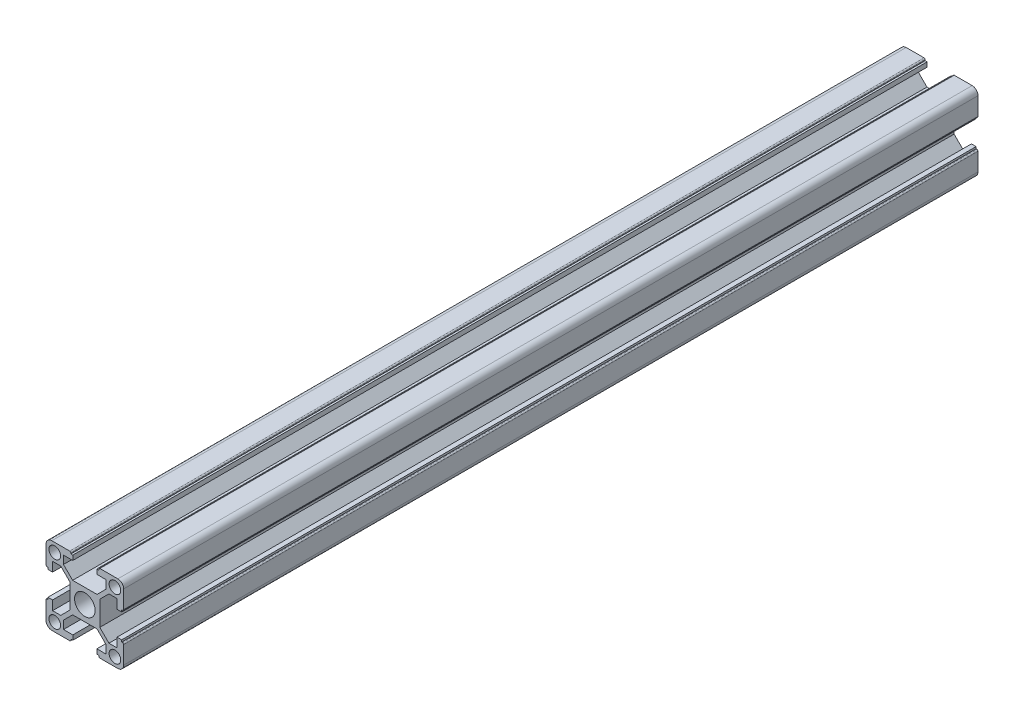
from build123d import *

# Parameters (mm, degrees)
SKETCH_1_R          = 2.65
SKETCH_1_R_2        = 1.5
EXTRUDE_1_DEPTH     = 110
SKETCH_4_R          = 2
CUT_EXTRUDE_3_DEPTH = 112.318563142


with BuildPart() as part:
    # 草图1 → 凸台-拉伸1 (new, symmetric)
    with BuildSketch(Plane.XY):
        with BuildLine():
            Line((3.142893219, 3.85), (-3.142893219, 3.85))
            Line((-3.142893219, 3.85), (-5.5, 6.207106781))
            Line((-5.5, 6.207106781), (-5.5, 8.3))
            Line((-5.5, 8.3), (-3.1, 8.3))
            Line((-3.1, 8.3), (-3.1, 9.5))
            Line((-3.1, 9.5), (-3.6, 9.5))
            Line((-3.6, 9.5), (-3.6, 9.7))
            ThreePointArc((-3.6, 9.7), (-3.687867966, 9.912132034), (-3.9, 10))
            Line((-3.9, 10), (-8.5, 10))
            ThreePointArc((-8.5, 10), (-9.560660172, 9.560660172), (-10, 8.5))
            Line((-10, 8.5), (-10, 3.9))
            ThreePointArc((-10, 3.9), (-9.912132034, 3.687867966), (-9.7, 3.6))
            Line((-9.7, 3.6), (-9.5, 3.6))
            Line((-9.5, 3.6), (-9.5, 3.1))
            Line((-9.5, 3.1), (-8.3, 3.1))
            Line((-8.3, 3.1), (-8.3, 5.5))
            Line((-8.3, 5.5), (-6.207106781, 5.5))
            Line((-6.207106781, 5.5), (-3.85, 3.142893219))
            Line((-3.85, 3.142893219), (-3.85, -3.142893219))
            Line((-3.85, -3.142893219), (-6.207106781, -5.5))
            Line((-6.207106781, -5.5), (-8.3, -5.5))
            Line((-8.3, -5.5), (-8.3, -3.1))
            Line((-8.3, -3.1), (-9.5, -3.1))
            Line((-9.5, -3.1), (-9.5, -3.6))
            Line((-9.5, -3.6), (-9.7, -3.6))
            ThreePointArc((-9.7, -3.6), (-9.912132034, -3.687867966), (-10, -3.9))
            Line((-10, -3.9), (-10, -8.5))
            ThreePointArc((-10, -8.5), (-9.560660172, -9.560660172), (-8.5, -10))
            Line((-8.5, -10), (-3.9, -10))
            ThreePointArc((-3.9, -10), (-3.687867966, -9.912132034), (-3.6, -9.7))
            Line((-3.6, -9.7), (-3.6, -9.5))
            Line((-3.6, -9.5), (-3.1, -9.5))
            Line((-3.1, -9.5), (-3.1, -8.3))
            Line((-3.1, -8.3), (-5.5, -8.3))
            Line((-5.5, -8.3), (-5.5, -6.207106781))
            Line((-5.5, -6.207106781), (-3.142893219, -3.85))
            Line((-3.142893219, -3.85), (3.142893219, -3.85))
            Line((3.142893219, -3.85), (5.5, -6.207106781))
            Line((5.5, -6.207106781), (5.5, -8.3))
            Line((5.5, -8.3), (3.1, -8.3))
            Line((3.1, -8.3), (3.1, -9.5))
            Line((3.1, -9.5), (3.6, -9.5))
            Line((3.6, -9.5), (3.6, -9.7))
            ThreePointArc((3.6, -9.7), (3.687867966, -9.912132034), (3.9, -10))
            Line((3.9, -10), (8.5, -10))
            ThreePointArc((8.5, -10), (9.560660172, -9.560660172), (10, -8.5))
            Line((10, -8.5), (10, -3.9))
            ThreePointArc((10, -3.9), (9.912132034, -3.687867966), (9.7, -3.6))
            Line((9.7, -3.6), (9.5, -3.6))
            Line((9.5, -3.6), (9.5, -3.1))
            Line((9.5, -3.1), (8.3, -3.1))
            Line((8.3, -3.1), (8.3, -5.5))
            Line((8.3, -5.5), (6.207106781, -5.5))
            Line((6.207106781, -5.5), (3.85, -3.142893219))
            Line((3.85, -3.142893219), (3.85, 3.142893219))
            Line((3.85, 3.142893219), (6.207106781, 5.5))
            Line((6.207106781, 5.5), (8.3, 5.5))
            Line((8.3, 5.5), (8.3, 3.1))
            Line((8.3, 3.1), (9.5, 3.1))
            Line((9.5, 3.1), (9.5, 3.6))
            Line((9.5, 3.6), (9.7, 3.6))
            ThreePointArc((9.7, 3.6), (9.912132034, 3.687867966), (10, 3.9))
            Line((10, 3.9), (10, 8.5))
            ThreePointArc((10, 8.5), (9.560660172, 9.560660172), (8.5, 10))
            Line((8.5, 10), (3.9, 10))
            ThreePointArc((3.9, 10), (3.687867966, 9.912132034), (3.6, 9.7))
            Line((3.6, 9.7), (3.6, 9.5))
            Line((3.6, 9.5), (3.1, 9.5))
            Line((3.1, 9.5), (3.1, 8.3))
            Line((3.1, 8.3), (5.5, 8.3))
            Line((5.5, 8.3), (5.5, 6.207106781))
            Line((5.5, 6.207106781), (3.142893219, 3.85))
        make_face()
        Circle(SKETCH_1_R, mode=Mode.SUBTRACT)
        with Locations((-7.75, 7.75)):
            Circle(SKETCH_1_R_2, mode=Mode.SUBTRACT)
        with Locations((7.75, 7.75)):
            Circle(SKETCH_1_R_2, mode=Mode.SUBTRACT)
        with Locations((7.75, -7.75)):
            Circle(SKETCH_1_R_2, mode=Mode.SUBTRACT)
        with Locations((-7.75, -7.75)):
            Circle(SKETCH_1_R_2, mode=Mode.SUBTRACT)
    extrude(amount=EXTRUDE_1_DEPTH, both=True)

    # 草图4 → 切除-拉伸3 (cut, through all)
    with BuildSketch(Plane(origin=(3.85, 0, 0), x_dir=(0, 0, -1), z_dir=(1, 0, 0))):
        with Locations((-100, 0)):
            Circle(SKETCH_4_R)
        with Locations((100, 0)):
            Circle(SKETCH_4_R)
        with Locations((-45, 0)):
            Circle(SKETCH_4_R)
        with Locations((-80, 0)):
            Circle(SKETCH_4_R)
        with Locations(Location((45, 0, 0), (0, 0, 180))):
            Circle(SKETCH_4_R)
        with Locations(Location((80, 0, 0), (0, 0, 180))):
            Circle(SKETCH_4_R)
    extrude(amount=-CUT_EXTRUDE_3_DEPTH, mode=Mode.SUBTRACT)


solid = part.part
